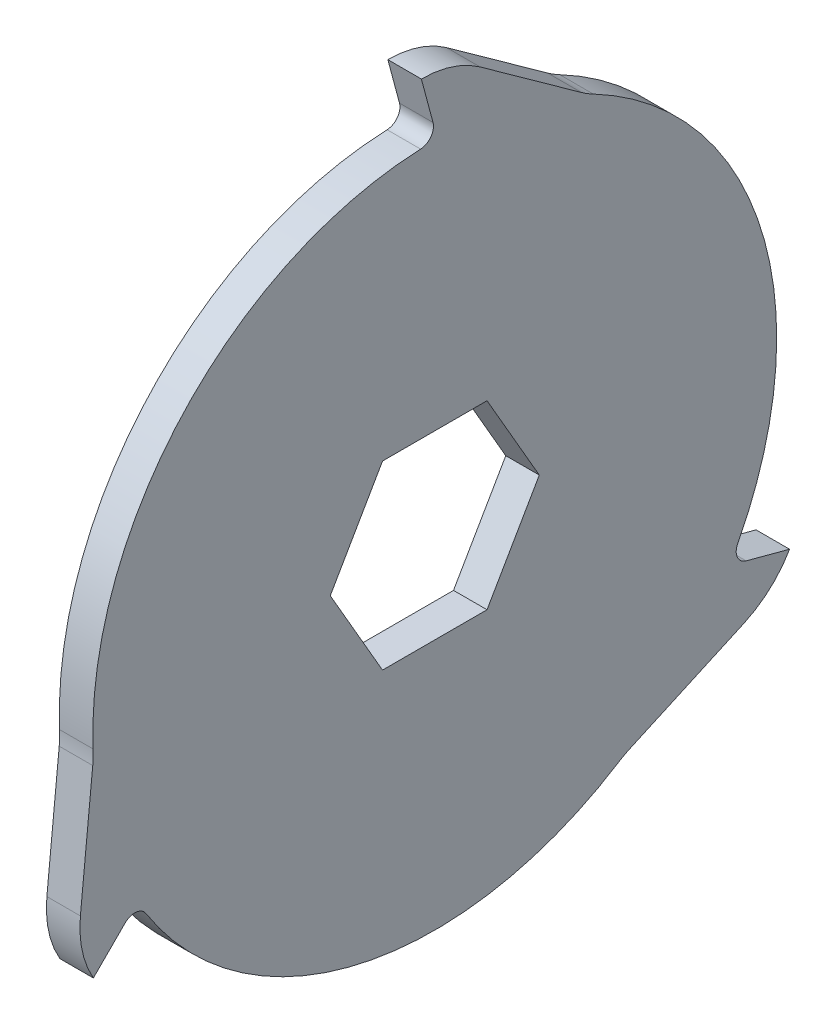
from build123d import *

# Parameters (mm, degrees)
SKETCH1_R         = 51
EXTRUDE1_DEPTH    = 2.5
EXTRUDE2_DEPTH    = 2.5
CIRPATTERN1_COUNT = 3


with BuildPart() as part:
    # Sketch1 → Extrude1 (new, symmetric)
    with BuildSketch(Plane(origin=(0, 0, 0), x_dir=(0, 0, -1), z_dir=(1, 0, 0))):
        Circle(SKETCH1_R)
        Polygon((7.794228634, 13.5), (-7.794228634, 13.5), (-15.588457268, 0), (-7.794228634, -13.5), (7.794228634, -13.5), (15.588457268, 0), align=None, mode=Mode.SUBTRACT)
    extrude(amount=EXTRUDE1_DEPTH, both=True)

    # Sketch2 → Extrude2 (add, symmetric)
    with BuildSketch(Plane(origin=(0, 0, 0), x_dir=(0, 0, -1), z_dir=(1, 0, 0))):
        with BuildLine():
            Line((-2, 59.956265369), (-0.262596806, 53.472188376))
            ThreePointArc((-0.262596806, 53.472188376), (-0.582870999, 51.770144067), (-2.111639083, 50.956265369))
            ThreePointArc((-2.111639083, 50.956265369), (11.148765219, 49.766505142), (23.649399595, 45.185239833))
            ThreePointArc((23.649399595, 45.185239833), (22.732801751, 45.706819988), (21.855117489, 46.291514612))
            Line((21.855117489, 46.291514612), (6.74998787, 57.139767012))
            ThreePointArc((6.74998787, 57.139767012), (2.596056753, 59.234789884), (-2, 59.956265369))
        make_face()
    extrude2 = extrude(amount=EXTRUDE2_DEPTH, both=True)

    # CirPattern1: Extrude2 ×3 about axis
    cirpattern1_axis = Axis((-5.5, 0, 0), (1, 0, 0))
    for i in range(1, CIRPATTERN1_COUNT):
        add(extrude2.rotate(cirpattern1_axis, i * 360 / CIRPATTERN1_COUNT))


solid = part.part
